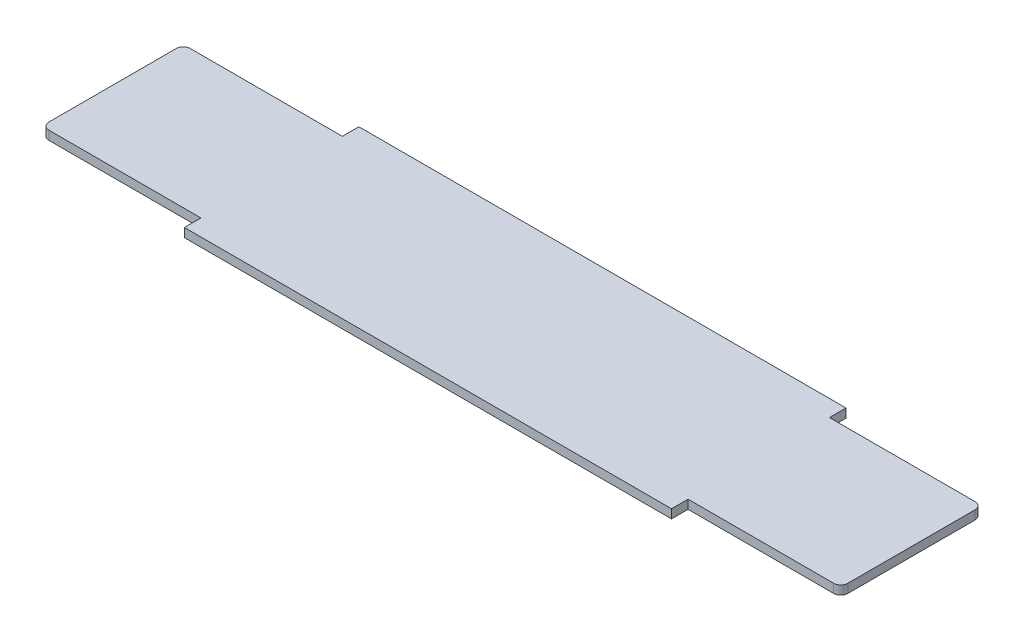
from build123d import *

# Parameters (mm, degrees)
SKETCH1_W           = 287.02
SKETCH1_H           = 50.8
BOSS_EXTRUDE1_DEPTH = 3.175
SKETCH2_W           = 175.006
SKETCH2_H           = 5.9436
BOSS_EXTRUDE2_DEPTH = 3.175
FILLET1_R           = 2.54
FILLET2_R           = 2.54


with BuildPart() as part:
    # Sketch1 → Boss-Extrude1 (new body)
    with BuildSketch(Plane(origin=(0, 0, 0), x_dir=(1, 0, 0), z_dir=(0, 1, 0))):
        with Locations((-143.51, 25.4)):
            Rectangle(SKETCH1_W, SKETCH1_H)
    extrude(amount=BOSS_EXTRUDE1_DEPTH)

    # Sketch2 → Boss-Extrude2 (add)
    with BuildSketch(Plane(origin=(0, 3.175, 0), x_dir=(1, 0, 0), z_dir=(0, 1, 0))):
        with Locations((-142.367, -2.9718)):
            Rectangle(SKETCH2_W, SKETCH2_H)
        with Locations((-142.367, 53.7718)):
            Rectangle(SKETCH2_W, SKETCH2_H)
    extrude(amount=-BOSS_EXTRUDE2_DEPTH)

    # Fillet1
    fillet1_edges = [part.edges().sort_by_distance(p)[0] for p in [
        (0, 1.5875, -50.8),
        (0, 1.5875, 0),
    ]]
    fillet(fillet1_edges, radius=FILLET1_R)

    # Fillet2
    fillet2_edges = [part.edges().sort_by_distance(p)[0] for p in [
        (-287.02, 1.5875, 0),
        (-287.02, 1.5875, -50.8),
    ]]
    fillet(fillet2_edges, radius=FILLET2_R)


solid = part.part
